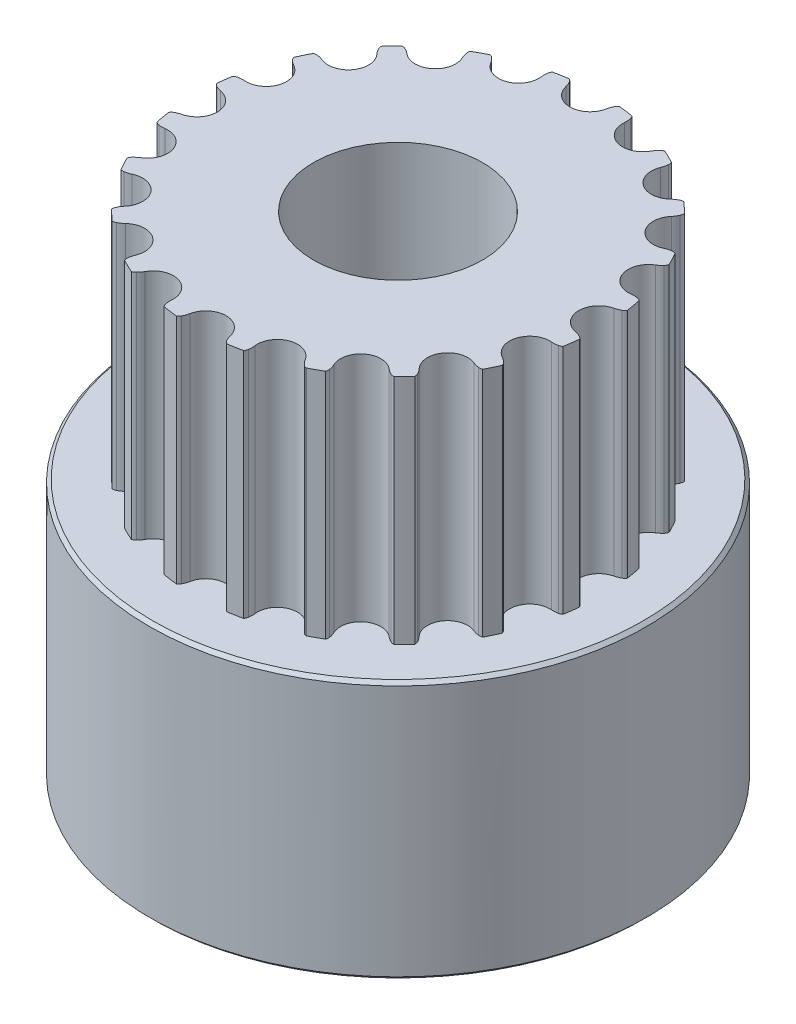
from build123d import *
from build123d.topology import SkipClean

# Parameters (mm, degrees)
P_IDAT_START            = 7.8
SKICA1_R                = 2.5
P_IDAT_VYSUNUT_M1_DEPTH = 7
SKICA2_R                = 3.5
SKICA2_R_2              = 2.5
P_IDAT_VYSUNUT_M2_DEPTH = 7.8
SKICA6_R                = 7.5
SKICA6_R_2              = 3.5
P_IDAT_VYSUNUT_M5_DEPTH = 7.8
ZKOSEN_3_SIZE           = 0.1
SKETCH19_R              = 1.5
CUT_EXTRUDE6_DEPTH      = 8
SKETCH20_R              = 1.5
CUT_EXTRUDE7_DEPTH      = 8
SKETCH21_R              = 2.55
CUT_EXTRUDE8_DEPTH      = 30


with BuildPart() as part:
    # Skica1 → Přidat vysunutím1 (new body)
    with BuildSketch(Plane(origin=(0, 0, 0), x_dir=(1, 0, 0), z_dir=(0, 1, 0)).offset(P_IDAT_START)):
        with BuildLine():
            ThreePointArc((-5.730143195, 1.098270155), (-5.09645097, 1.530497044), (-5.387174672, 2.240331989))
            ThreePointArc((-5.387174672, 2.240331989), (-5.468060657, 2.292707421), (-5.540463547, 2.356296335))
            ThreePointArc((-5.540463547, 2.356296335), (-5.573874331, 2.399596558), (-5.596043873, 2.44959357))
            ThreePointArc((-5.596043873, 2.44959357), (-5.50369925, 2.650567912), (-5.404139771, 2.848067596))
            ThreePointArc((-5.404139771, 2.848067596), (-5.351227535, 2.86190541), (-5.296542742, 2.862779021))
            ThreePointArc((-5.296542742, 2.862779021), (-5.201685094, 2.845815675), (-5.110305882, 2.815228615))
            ThreePointArc((-5.110305882, 2.815228615), (-4.374063308, 3.030479148), (-4.431206919, 3.795410862))
            ThreePointArc((-4.431206919, 3.795410862), (-4.491949163, 3.870218002), (-4.541158349, 3.953068377))
            ThreePointArc((-4.541158349, 3.953068377), (-4.559553388, 4.004573836), (-4.565187949, 4.058974585))
            ThreePointArc((-4.565187949, 4.058974585), (-4.415258506, 4.221576484), (-4.259541056, 4.378644275))
            ThreePointArc((-4.259541056, 4.378644275), (-4.204942409, 4.375454038), (-4.15266412, 4.359386362))
            ThreePointArc((-4.15266412, 4.359386362), (-4.067691098, 4.313940635), (-3.990236225, 4.256612884))
            ThreePointArc((-3.990236225, 4.256612884), (-3.223511854, 4.233816838), (-3.041481758, 4.978968476))
            ThreePointArc((-3.041481758, 4.978968476), (-3.076134388, 5.06888468), (-3.097332931, 5.162886543))
            ThreePointArc((-3.097332931, 5.162886543), (-3.09891159, 5.217555525), (-3.08745962, 5.271034888))
            ThreePointArc((-3.08745962, 5.271034888), (-2.894621497, 5.379347737), (-2.697988784, 5.480608745))
            ThreePointArc((-2.697988784, 5.480608745), (-2.647048223, 5.460702739), (-2.6022938, 5.429266591))
            ThreePointArc((-2.6022938, 5.429266591), (-2.535523156, 5.359787029), (-2.479574443, 5.281330225))
            ThreePointArc((-2.479574443, 5.281330225), (-1.7574206, 5.022719037), (-1.354035171, 5.675149965))
            ThreePointArc((-1.354035171, 5.675149965), (-1.359206146, 5.771373608), (-1.350318985, 5.867325402))
            ThreePointArc((-1.350318985, 5.867325402), (-1.334926735, 5.919806527), (-1.307509232, 5.967129569))
            ThreePointArc((-1.307509232, 5.967129569), (-1.090638767, 6.010550954), (-0.872338572, 6.046093045))
            ThreePointArc((-0.872338572, 6.046093045), (-0.830042514, 6.01141981), (-0.797192832, 5.967692379))
            ThreePointArc((-0.797192832, 5.967692379), (-0.755160541, 5.880980125), (-0.726194639, 5.789074167))
            ThreePointArc((-0.726194639, 5.789074167), (-0.119300773, 5.319962501), (0.465953812, 5.815808234))
            ThreePointArc((0.465953812, 5.815808234), (0.490770664, 5.908920276), (0.528873591, 5.997429571))
            ThreePointArc((0.528873591, 5.997429571), (0.55973005, 6.04258562), (0.600429269, 6.079120034))
            ThreePointArc((0.600429269, 6.079120034), (0.820103284, 6.053399565), (1.038702217, 6.019743632))
            ThreePointArc((1.038702217, 6.019743632), (1.06821354, 5.973697225), (1.085942924, 5.921958857))
            ThreePointArc((1.085942924, 5.921958857), (1.099122448, 5.826501911), (1.098270155, 5.730143195))
            ThreePointArc((1.098270155, 5.730143195), (1.530497044, 5.09645097), (2.240331989, 5.387174672))
            ThreePointArc((2.240331989, 5.387174672), (2.292707421, 5.468060657), (2.356296335, 5.540463547))
            ThreePointArc((2.356296335, 5.540463547), (2.399596558, 5.573874331), (2.44959357, 5.596043873))
            ThreePointArc((2.44959357, 5.596043873), (2.650567912, 5.50369925), (2.848067596, 5.404139771))
            ThreePointArc((2.848067596, 5.404139771), (2.86190541, 5.351227535), (2.862779021, 5.296542742))
            ThreePointArc((2.862779021, 5.296542742), (2.845815675, 5.201685094), (2.815228615, 5.110305882))
            ThreePointArc((2.815228615, 5.110305882), (3.030479148, 4.374063308), (3.795410862, 4.431206919))
            ThreePointArc((3.795410862, 4.431206919), (3.870218002, 4.491949163), (3.953068377, 4.541158349))
            ThreePointArc((3.953068377, 4.541158349), (4.004573836, 4.559553388), (4.058974585, 4.565187949))
            ThreePointArc((4.058974585, 4.565187949), (4.221576484, 4.415258506), (4.378644275, 4.259541056))
            ThreePointArc((4.378644275, 4.259541056), (4.375454038, 4.204942409), (4.359386362, 4.15266412))
            ThreePointArc((4.359386362, 4.15266412), (4.313940635, 4.067691098), (4.256612884, 3.990236225))
            ThreePointArc((4.256612884, 3.990236225), (4.233816838, 3.223511854), (4.978968476, 3.041481758))
            ThreePointArc((4.978968476, 3.041481758), (5.06888468, 3.076134388), (5.162886543, 3.097332931))
            ThreePointArc((5.162886543, 3.097332931), (5.217555525, 3.09891159), (5.271034888, 3.08745962))
            ThreePointArc((5.271034888, 3.08745962), (5.379347737, 2.894621497), (5.480608745, 2.697988784))
            ThreePointArc((5.480608745, 2.697988784), (5.460702739, 2.647048223), (5.429266591, 2.6022938))
            ThreePointArc((5.429266591, 2.6022938), (5.359787029, 2.535523156), (5.281330225, 2.479574443))
            ThreePointArc((5.281330225, 2.479574443), (5.022719037, 1.7574206), (5.675149965, 1.354035171))
            ThreePointArc((5.675149965, 1.354035171), (5.771373608, 1.359206146), (5.867325402, 1.350318985))
            ThreePointArc((5.867325402, 1.350318985), (5.919806527, 1.334926735), (5.967129569, 1.307509232))
            ThreePointArc((5.967129569, 1.307509232), (6.010550954, 1.090638767), (6.046093045, 0.872338572))
            ThreePointArc((6.046093045, 0.872338572), (6.01141981, 0.830042514), (5.967692379, 0.797192832))
            ThreePointArc((5.967692379, 0.797192832), (5.880980125, 0.755160541), (5.789074167, 0.726194639))
            ThreePointArc((5.789074167, 0.726194639), (5.319962501, 0.119300773), (5.815808234, -0.465953812))
            ThreePointArc((5.815808234, -0.465953812), (5.908920276, -0.490770664), (5.997429571, -0.528873591))
            ThreePointArc((5.997429571, -0.528873591), (6.04258562, -0.55973005), (6.079120034, -0.600429269))
            ThreePointArc((6.079120034, -0.600429269), (6.053399565, -0.820103284), (6.019743632, -1.038702217))
            ThreePointArc((6.019743632, -1.038702217), (5.973697225, -1.06821354), (5.921958857, -1.085942924))
            ThreePointArc((5.921958857, -1.085942924), (5.826501911, -1.099122448), (5.730143195, -1.098270155))
            ThreePointArc((5.730143195, -1.098270155), (5.09645097, -1.530497044), (5.387174672, -2.240331989))
            ThreePointArc((5.387174672, -2.240331989), (5.468060657, -2.292707421), (5.540463547, -2.356296335))
            ThreePointArc((5.540463547, -2.356296335), (5.573874331, -2.399596558), (5.596043873, -2.44959357))
            ThreePointArc((5.596043873, -2.44959357), (5.50369925, -2.650567911), (5.404139771, -2.848067596))
            ThreePointArc((5.404139771, -2.848067596), (5.351227535, -2.86190541), (5.296542742, -2.862779021))
            ThreePointArc((5.296542742, -2.862779021), (5.201685094, -2.845815675), (5.110305882, -2.815228615))
            ThreePointArc((5.110305882, -2.815228615), (4.374063308, -3.030479148), (4.431206919, -3.795410862))
            ThreePointArc((4.431206919, -3.795410862), (4.491949163, -3.870218002), (4.541158349, -3.953068377))
            ThreePointArc((4.541158349, -3.953068377), (4.559553388, -4.004573836), (4.565187949, -4.058974585))
            ThreePointArc((4.565187949, -4.058974585), (4.415258506, -4.221576484), (4.259541056, -4.378644275))
            ThreePointArc((4.259541056, -4.378644275), (4.204942409, -4.375454038), (4.15266412, -4.359386362))
            ThreePointArc((4.15266412, -4.359386362), (4.067691098, -4.313940635), (3.990236225, -4.256612884))
            ThreePointArc((3.990236225, -4.256612884), (3.223511854, -4.233816838), (3.041481758, -4.978968476))
            ThreePointArc((3.041481758, -4.978968476), (3.076134388, -5.06888468), (3.097332931, -5.162886543))
            ThreePointArc((3.097332931, -5.162886543), (3.09891159, -5.217555525), (3.08745962, -5.271034888))
            ThreePointArc((3.08745962, -5.271034888), (2.894621497, -5.379347737), (2.697988784, -5.480608745))
            ThreePointArc((2.697988784, -5.480608745), (2.647048223, -5.460702739), (2.6022938, -5.429266591))
            ThreePointArc((2.6022938, -5.429266591), (2.535523156, -5.359787029), (2.479574443, -5.281330225))
            ThreePointArc((2.479574443, -5.281330225), (1.7574206, -5.022719037), (1.354035171, -5.675149965))
            ThreePointArc((1.354035171, -5.675149965), (1.359206146, -5.771373608), (1.350318985, -5.867325402))
            ThreePointArc((1.350318985, -5.867325402), (1.334926735, -5.919806527), (1.307509232, -5.967129569))
            ThreePointArc((1.307509232, -5.967129569), (1.090638767, -6.010550954), (0.872338572, -6.046093045))
            ThreePointArc((0.872338572, -6.046093045), (0.830042514, -6.01141981), (0.797192832, -5.967692379))
            ThreePointArc((0.797192832, -5.967692379), (0.755160541, -5.880980125), (0.726194639, -5.789074167))
            ThreePointArc((0.726194639, -5.789074167), (0.119300773, -5.319962501), (-0.465953812, -5.815808234))
            ThreePointArc((-0.465953812, -5.815808234), (-0.490770664, -5.908920276), (-0.528873591, -5.997429571))
            ThreePointArc((-0.528873591, -5.997429571), (-0.55973005, -6.04258562), (-0.600429269, -6.079120034))
            ThreePointArc((-0.600429269, -6.079120034), (-0.820103284, -6.053399565), (-1.038702217, -6.019743632))
            ThreePointArc((-1.038702217, -6.019743632), (-1.06821354, -5.973697225), (-1.085942924, -5.921958857))
            ThreePointArc((-1.085942924, -5.921958857), (-1.099122448, -5.826501911), (-1.098270155, -5.730143195))
            ThreePointArc((-1.098270155, -5.730143195), (-1.530497044, -5.09645097), (-2.240331989, -5.387174672))
            ThreePointArc((-2.240331989, -5.387174672), (-2.292707421, -5.468060657), (-2.356296335, -5.540463547))
            ThreePointArc((-2.356296335, -5.540463547), (-2.399596558, -5.573874331), (-2.44959357, -5.596043873))
            ThreePointArc((-2.44959357, -5.596043873), (-2.650567912, -5.50369925), (-2.848067596, -5.404139771))
            ThreePointArc((-2.848067596, -5.404139771), (-2.86190541, -5.351227535), (-2.862779021, -5.296542742))
            ThreePointArc((-2.862779021, -5.296542742), (-2.845815675, -5.201685094), (-2.815228615, -5.110305882))
            ThreePointArc((-2.815228615, -5.110305882), (-3.030479148, -4.374063308), (-3.795410862, -4.431206919))
            ThreePointArc((-3.795410862, -4.431206919), (-3.870218002, -4.491949163), (-3.953068377, -4.541158349))
            ThreePointArc((-3.953068377, -4.541158349), (-4.004573836, -4.559553388), (-4.058974585, -4.565187949))
            ThreePointArc((-4.058974585, -4.565187949), (-4.221576484, -4.415258506), (-4.378644275, -4.259541056))
            ThreePointArc((-4.378644275, -4.259541056), (-4.375454038, -4.204942409), (-4.359386362, -4.15266412))
            ThreePointArc((-4.359386362, -4.15266412), (-4.313940635, -4.067691098), (-4.256612884, -3.990236225))
            ThreePointArc((-4.256612884, -3.990236225), (-4.233816838, -3.223511854), (-4.978968476, -3.041481758))
            ThreePointArc((-4.978968476, -3.041481758), (-5.06888468, -3.076134388), (-5.162886543, -3.097332931))
            ThreePointArc((-5.162886543, -3.097332931), (-5.217555525, -3.09891159), (-5.271034888, -3.08745962))
            ThreePointArc((-5.271034888, -3.08745962), (-5.379347737, -2.894621497), (-5.480608745, -2.697988784))
            ThreePointArc((-5.480608745, -2.697988784), (-5.460702739, -2.647048223), (-5.429266591, -2.6022938))
            ThreePointArc((-5.429266591, -2.6022938), (-5.359787029, -2.535523156), (-5.281330225, -2.479574443))
            ThreePointArc((-5.281330225, -2.479574443), (-5.022719037, -1.7574206), (-5.675149965, -1.354035171))
            ThreePointArc((-5.675149965, -1.354035171), (-5.771373608, -1.359206146), (-5.867325402, -1.350318985))
            ThreePointArc((-5.867325402, -1.350318985), (-5.919806527, -1.334926735), (-5.967129569, -1.307509232))
            ThreePointArc((-5.967129569, -1.307509232), (-6.010550954, -1.090638767), (-6.046093045, -0.872338572))
            ThreePointArc((-6.046093045, -0.872338572), (-6.01141981, -0.830042514), (-5.967692379, -0.797192832))
            ThreePointArc((-5.967692379, -0.797192832), (-5.880980125, -0.755160541), (-5.789074167, -0.726194639))
            ThreePointArc((-5.789074167, -0.726194639), (-5.319962501, -0.119300773), (-5.815808234, 0.465953812))
            ThreePointArc((-5.815808234, 0.465953812), (-5.908920276, 0.490770664), (-5.997429571, 0.528873591))
            ThreePointArc((-5.997429571, 0.528873591), (-6.04258562, 0.55973005), (-6.079120034, 0.600429269))
            ThreePointArc((-6.079120034, 0.600429269), (-6.053399565, 0.820103284), (-6.019743632, 1.038702217))
            ThreePointArc((-6.019743632, 1.038702217), (-5.973697225, 1.06821354), (-5.921958857, 1.085942924))
            ThreePointArc((-5.921958857, 1.085942924), (-5.826501911, 1.099122448), (-5.730143195, 1.098270155))
        make_face()
        with Locations(Location((0, 0, 0), (0, 0, 270))):
            Circle(SKICA1_R, mode=Mode.SUBTRACT)
    extrude(amount=P_IDAT_VYSUNUT_M1_DEPTH)

    # Skica2 → Přidat vysunutím2 (add)
    with SkipClean():  # the faces are left unmerged after this step: merging them gives an invalid solid
        with BuildSketch(Plane.XZ.offset(-7.8).offset(P_IDAT_START)):
            with Locations(Location((0, 0, 0), (0, 0, 90))):
                Circle(SKICA2_R)
            with Locations(Location((0, 0, 0), (0, 0, 270))):
                Circle(SKICA2_R_2, mode=Mode.SUBTRACT)
        extrude(amount=-P_IDAT_VYSUNUT_M2_DEPTH)


with BuildPart() as body_2:
    # Skica6 → Přidat vysunutím5 (new body)
    with BuildSketch(Plane.XZ):
        with Locations(Location((0, 0, 0), (0, 0, 270))):
            Circle(SKICA6_R)
        with Locations(Location((0, 0, 0), (0, 0, 270))):
            Circle(SKICA6_R_2, mode=Mode.SUBTRACT)
    extrude(amount=-P_IDAT_VYSUNUT_M5_DEPTH)

    # Zkosení3
    zkosen_3_edges = [body_2.edges().sort_by_distance(p)[0] for p in [
        (0, 0, 7.5),
        (0, 7.8, 7.5),
    ]]
    chamfer(zkosen_3_edges, length=ZKOSEN_3_SIZE)


with BuildPart() as cut_extrude6_tool:
    # Sketch19 → Cut-Extrude6 (new body)
    with SkipClean():  # the faces are left unmerged after this step: merging them gives an invalid solid
        with BuildSketch(Plane(origin=(0, 0, -7.5), x_dir=(-1, 0, 0), z_dir=(0, 0, -1))):
            with Locations(Location((0, 3.9, 0), (0, 0, 90))):
                Circle(SKETCH19_R)
        extrude(amount=-CUT_EXTRUDE6_DEPTH)


with BuildPart() as part_1:
    with SkipClean():  # the faces are left unmerged after this step: merging them gives an invalid solid
        add(part.part)

        # Cut-Extrude6: cut by cut_extrude6_tool
        add(cut_extrude6_tool.part, mode=Mode.SUBTRACT)


with BuildPart() as body_2_1:
    with SkipClean():  # the faces are left unmerged after this step: merging them gives an invalid solid
        add(body_2.part)

        # Cut-Extrude6: cut by cut_extrude6_tool
        add(cut_extrude6_tool.part, mode=Mode.SUBTRACT)


with BuildPart() as cut_extrude7_tool:
    # Sketch20 → Cut-Extrude7 (new body)
    with SkipClean():  # the faces are left unmerged after this step: merging them gives an invalid solid
        with BuildSketch(Plane.ZY.offset(7.5)):
            with Locations((0, 3.9)):
                Circle(SKETCH20_R)
        extrude(amount=-CUT_EXTRUDE7_DEPTH)


with BuildPart() as part_2:
    with SkipClean():  # the faces are left unmerged after this step: merging them gives an invalid solid
        add(part_1.part)

        # Cut-Extrude7: cut by cut_extrude7_tool
        add(cut_extrude7_tool.part, mode=Mode.SUBTRACT)

    # Sketch21 → Cut-Extrude8 (cut)
    with BuildSketch(Plane(origin=(0, 16, 0), x_dir=(1, 0, 0), z_dir=(0, 1, 0))):
        with Locations(Location((0, 0, 0), (0, 0, 270))):
            Circle(SKETCH21_R)
    extrude(amount=-CUT_EXTRUDE8_DEPTH, mode=Mode.SUBTRACT)


with BuildPart() as body_2_2:
    with SkipClean():  # the faces are left unmerged after this step: merging them gives an invalid solid
        add(body_2_1.part)

        # Cut-Extrude7: cut by cut_extrude7_tool
        add(cut_extrude7_tool.part, mode=Mode.SUBTRACT)


solid = Compound([part_2.part, body_2_2.part])
